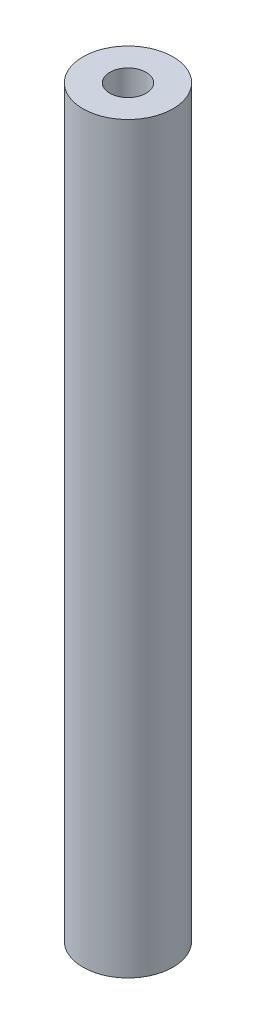
from build123d import *

# Parameters (mm, degrees)
SKETCH1_R                                = 5
BOSS_EXTRUDE2_DEPTH                      = 82.55
CUT_EXTRUDE1_DEPTH                       = 2.54
TAP_DRILL_FOR_10_32_TAP1_D               = 4.0386
TAP_DRILL_FOR_10_32_TAP1_DEPTH           = 11.486682152
TAP_DRILL_FOR_10_32_TAP1_TIP             = 1.213317848
TAP_DRILL_FOR_10_32_TAP1_ON_FACE_2_D     = 4.0386
TAP_DRILL_FOR_10_32_TAP1_ON_FACE_2_DEPTH = 11.486682152
TAP_DRILL_FOR_10_32_TAP1_ON_FACE_2_TIP   = 1.213317848


with BuildPart() as part:
    # Sketch1 → Boss-Extrude2 (new body)
    with BuildSketch(Plane(origin=(0, 0, 0), x_dir=(1, 0, 0), z_dir=(0, 1, 0))):
        with Locations(Location((0, 0, 0), (0, 0, 270))):
            Circle(SKETCH1_R)
    extrude(amount=-BOSS_EXTRUDE2_DEPTH)

    # Sketch2 → Cut-Extrude1 (cut)
    with BuildSketch(Plane(origin=(0, 0, -5), x_dir=(-1, 0, 0), z_dir=(0, 0, -1))):
        with BuildLine():
            Line((-2, -109.22), (-2, -114.22))
            ThreePointArc((-2, -114.22), (0, -116.22), (2, -114.22))
            Line((2, -114.22), (2, -109.22))
            ThreePointArc((2, -109.22), (0, -107.22), (-2, -109.22))
        make_face()
        with BuildLine():
            Line((-1.5, -63.5), (-1.5, -68.5))
            ThreePointArc((-1.5, -68.5), (0, -70), (1.5, -68.5))
            Line((1.5, -68.5), (1.5, -63.5))
            ThreePointArc((1.5, -63.5), (0, -62), (-1.5, -63.5))
        make_face()
        with BuildLine():
            Line((-1.5, -10.39), (-1.5, -15.39))
            ThreePointArc((-1.5, -15.39), (0, -16.89), (1.5, -15.39))
            Line((1.5, -15.39), (1.5, -10.39))
            ThreePointArc((1.5, -10.39), (0, -8.89), (-1.5, -10.39))
        make_face()
    extrude(amount=-CUT_EXTRUDE1_DEPTH, mode=Mode.SUBTRACT)

    # Tap Drill for #10-32 Tap1
    with Locations(Plane.ZX):
        with Locations((0, 0)):
            Hole(TAP_DRILL_FOR_10_32_TAP1_D / 2, depth=TAP_DRILL_FOR_10_32_TAP1_DEPTH)
            with Locations((0, 0, -(TAP_DRILL_FOR_10_32_TAP1_DEPTH + TAP_DRILL_FOR_10_32_TAP1_TIP / 2))):  # 118° drill point
                Cone(0, TAP_DRILL_FOR_10_32_TAP1_D / 2, TAP_DRILL_FOR_10_32_TAP1_TIP, mode=Mode.SUBTRACT)

    # Tap Drill for #10-32 Tap1 on face 2
    with Locations(Plane(origin=(0, -82.55, 0), x_dir=(0, 0, -1), z_dir=(0, -1, 0))):
        with Locations((0, 0)):
            Hole(TAP_DRILL_FOR_10_32_TAP1_ON_FACE_2_D / 2, depth=TAP_DRILL_FOR_10_32_TAP1_ON_FACE_2_DEPTH)
            with Locations((0, 0, -(TAP_DRILL_FOR_10_32_TAP1_ON_FACE_2_DEPTH + TAP_DRILL_FOR_10_32_TAP1_ON_FACE_2_TIP / 2))):  # 118° drill point
                Cone(0, TAP_DRILL_FOR_10_32_TAP1_ON_FACE_2_D / 2, TAP_DRILL_FOR_10_32_TAP1_ON_FACE_2_TIP, mode=Mode.SUBTRACT)


solid = part.part
